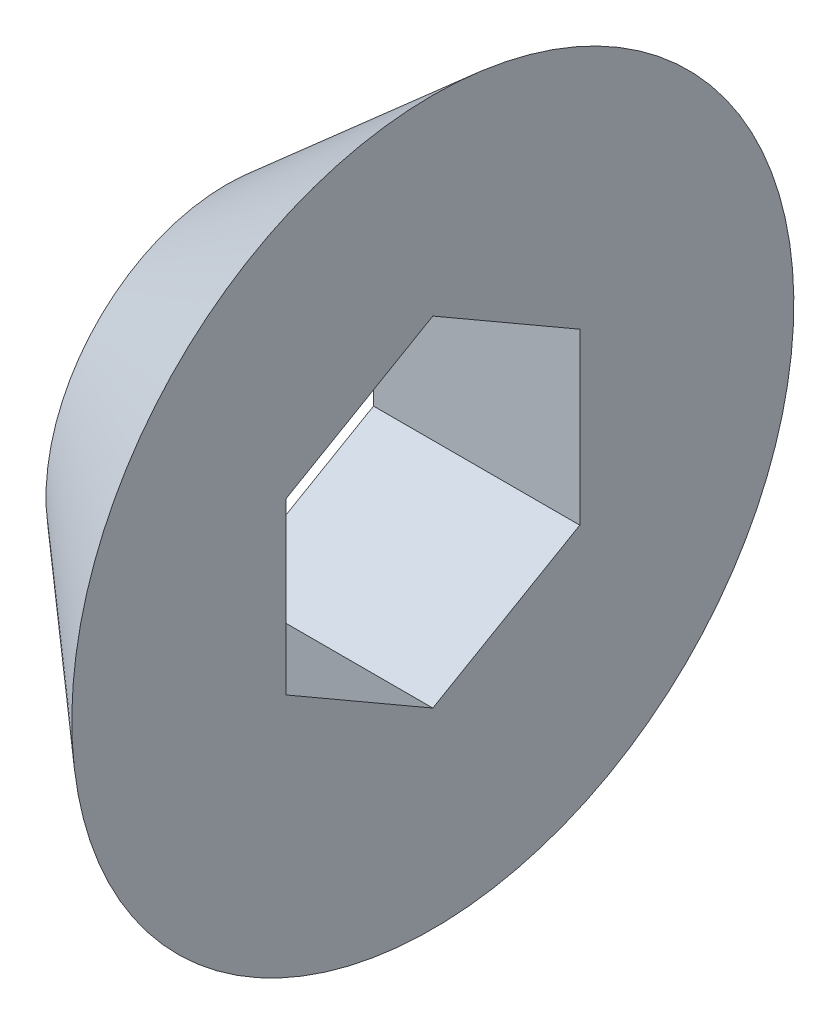
from build123d import *

# Parameters (mm, degrees)
CUT_EXTRUDE1_DEPTH = 11.677078252


with BuildPart() as part:
    # Sketch1 → Revolve1 (revolve)
    with BuildSketch(Plane.XY):
        Polygon((0, 0), (-4, 0), (-4, 3.5), (0, 7), align=None)
    revolve(axis=Axis((0, 0, 0), (-1, 0, 0)))

    # Sketch2 → Cut-Extrude1 (cut, through all)
    with BuildSketch(Plane.ZY.offset(4)):
        Polygon((0, 3.290896534), (-2.85, 1.645448267), (-2.85, -1.645448267), (0, -3.290896534), (2.85, -1.645448267), (2.85, 1.645448267), align=None)
    extrude(amount=-CUT_EXTRUDE1_DEPTH, mode=Mode.SUBTRACT)


solid = part.part
